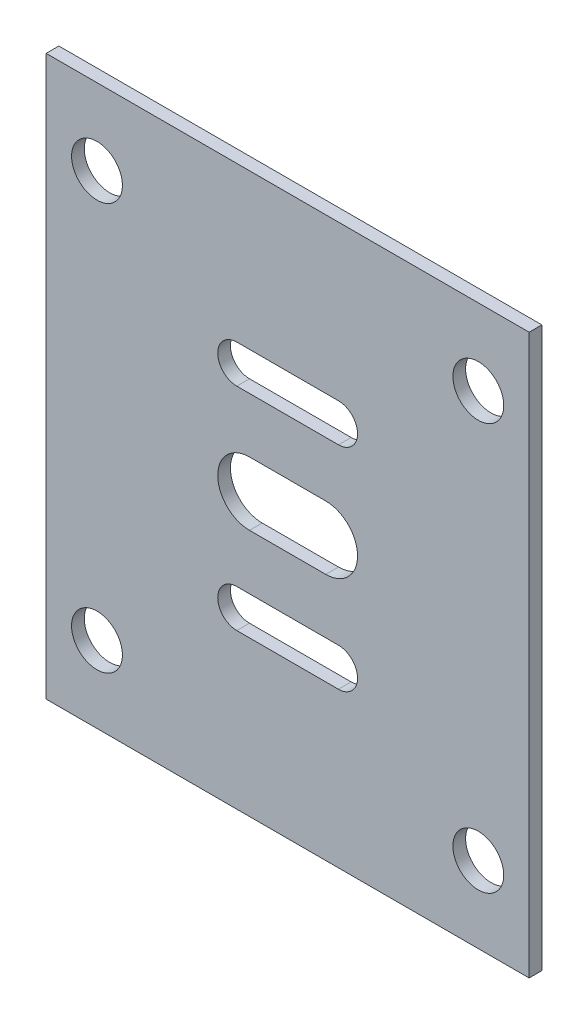
from build123d import *

# Parameters (mm, degrees)
SKETCH1_W               = 38
SKETCH1_H               = 44
SKETCH1_R               = 2
BOSS_EXTRUDE1_DEPTH     = 1
CUT_EXTRUDE1_DEPTH      = 30.086079144
CUT_EXTRUDE1_DEPTH_BACK = 30.086079144


with BuildPart() as part:
    # Sketch1 → Boss-Extrude1 (new body)
    with BuildSketch(Plane.XY):
        Rectangle(SKETCH1_W, SKETCH1_H)
        with Locations((-15, 16)):
            Circle(SKETCH1_R, mode=Mode.SUBTRACT)
        with Locations(Location((-15, -16, 0), (0, 0, 180))):
            Circle(SKETCH1_R, mode=Mode.SUBTRACT)
        with Locations((15, -16)):
            Circle(SKETCH1_R, mode=Mode.SUBTRACT)
        with Locations(Location((15, 16, 0), (0, 0, 180))):
            Circle(SKETCH1_R, mode=Mode.SUBTRACT)
    extrude(amount=BOSS_EXTRUDE1_DEPTH)

    # Sketch2 → Cut-Extrude1 (cut, two sides: drawn at the far end of the back side and taken through both)
    with BuildSketch(Plane.XY.offset(-CUT_EXTRUDE1_DEPTH_BACK)):
        with BuildLine():
            Line((-3, 2.5), (3, 2.5))
            ThreePointArc((3, 2.5), (5.5, 0), (3, -2.5))
            Line((3, -2.5), (-3, -2.5))
            ThreePointArc((-3, -2.5), (-5.5, 0), (-3, 2.5))
        make_face()
        with BuildLine():
            Line((-4, 9.827019403), (4, 9.827019403))
            ThreePointArc((4, 9.827019403), (5.5, 8.327019403), (4, 6.827019403))
            Line((4, 6.827019403), (-4, 6.827019403))
            ThreePointArc((-4, 6.827019403), (-5.5, 8.327019403), (-4, 9.827019403))
        make_face()
        with BuildLine():
            Line((-4, -9.827019403), (4, -9.827019403))
            ThreePointArc((4, -9.827019403), (5.5, -8.327019403), (4, -6.827019403))
            Line((4, -6.827019403), (-4, -6.827019403))
            ThreePointArc((-4, -6.827019403), (-5.5, -8.327019403), (-4, -9.827019403))
        make_face()
    extrude(amount=CUT_EXTRUDE1_DEPTH + CUT_EXTRUDE1_DEPTH_BACK, mode=Mode.SUBTRACT)


solid = part.part
